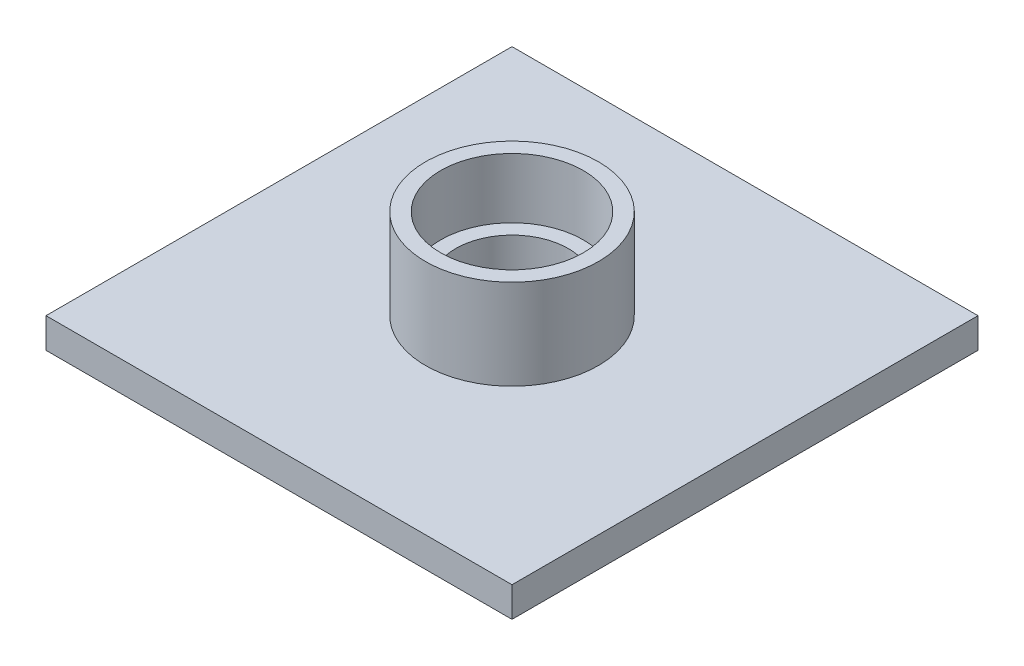
from build123d import *

# Parameters (mm, degrees)
SKETCH1_R           = 30.1625
SKETCH1_R_2         = 23.8125
ID_2_DEPTH          = 25.4
SKETCH2_R           = 36.576
SKETCH2_R_2         = 30.1625
OD_DEPTH            = 50.8
SKETCH4_R           = 23.8125
BOSS_EXTRUDE3_DEPTH = 12.7


with BuildPart() as part:
    # Sketch1 → ID 2 (new body)
    with BuildSketch(Plane(origin=(0, 0, 0), x_dir=(1, 0, 0), z_dir=(0, 1, 0))):
        with Locations(Location((0, 0, 0), (0, 0, 270))):
            Circle(SKETCH1_R)
        with Locations(Location((0, 0, 0), (0, 0, 270))):
            Circle(SKETCH1_R_2, mode=Mode.SUBTRACT)
    extrude(amount=ID_2_DEPTH)

    # Sketch2 → OD (add)
    with BuildSketch(Plane.XZ):
        with Locations(Location((0, 0, 0), (0, 0, 270))):
            Circle(SKETCH2_R)
        with Locations(Location((0, 0, 0), (0, 0, 270))):
            Circle(SKETCH2_R_2, mode=Mode.SUBTRACT)
    extrude(amount=-OD_DEPTH)

    # Sketch4 → Boss-Extrude3 (add)
    with BuildSketch(Plane.XZ):
        Polygon((0, 98.552), (-98.552, 98.552), (-98.552, 0), (-98.552, -98.552), (0, -98.552), (98.552, -98.552), (98.552, 0), (98.552, 98.552), align=None)
        with Locations(Location((0, 0, 0), (0, 0, 90))):
            Circle(SKETCH4_R, mode=Mode.SUBTRACT)
    extrude(amount=-BOSS_EXTRUDE3_DEPTH)


solid = part.part
